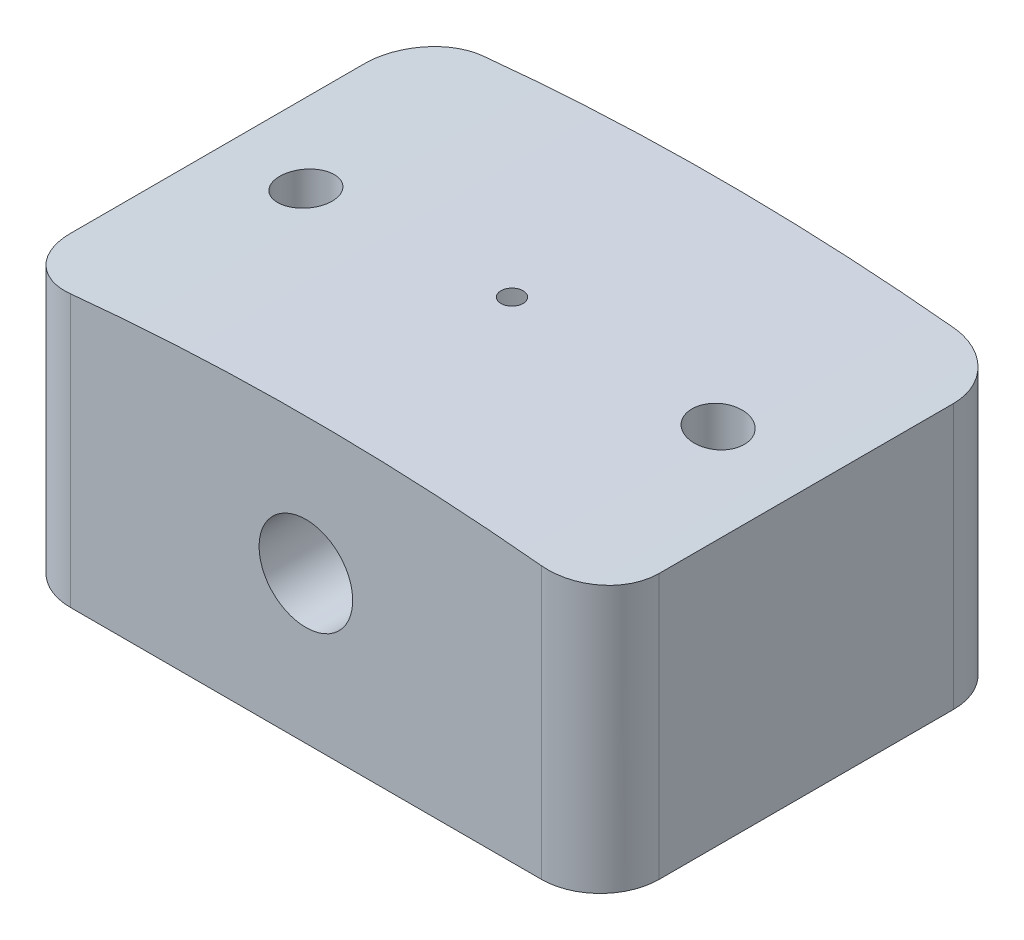
from build123d import *

# Parameters (mm, degrees)
BOSS_EXTRUDE1_DEPTH              = 8.89
BOSS_EXTRUDE1_DEPTH_BACK         = 8.89
F_3_8_0_375_DIAMETER_SLOT1_D     = 9.525
F_3_8_0_375_DIAMETER_SLOT1_DEPTH = 9.652
F_3_8_0_375_DIAMETER_SLOT1_TIP   = 2.861598698
TAP_DRILL_FOR_4_40_TAP1_D        = 2.2606
FILLET1_R                        = 2.54
F_10_32_TAPPED_HOLE1_D           = 4.0386


with BuildPart() as part:
    # Sketch1 → Boss-Extrude1 (new, two sides: drawn at the far end of the back side and taken through both)
    with BuildSketch(Plane.XY.offset(-BOSS_EXTRUDE1_DEPTH_BACK)):
        with BuildLine():
            Line((-12.698670317, 100.803292467), (-12.698670317, 89.373292467))
            Line((-12.698670317, 89.373292467), (12.698670317, 89.373292467))
            Line((12.698670317, 89.373292467), (12.698670317, 100.803292467))
            ThreePointArc((12.698670317, 100.803292467), (0, 101.6), (-12.698670317, 100.803292467))
        make_face()
    extrude(amount=BOSS_EXTRUDE1_DEPTH + BOSS_EXTRUDE1_DEPTH_BACK)

    # 3/8 (0.375) Diameter Slot1
    with Locations(Plane(origin=(0, 89.373292467, 0), x_dir=(-1, 0, 0), z_dir=(0, -1, 0))):
        with Locations((0, 0)):
            Hole(F_3_8_0_375_DIAMETER_SLOT1_D / 2, depth=F_3_8_0_375_DIAMETER_SLOT1_DEPTH)
            with Locations((0, 0, -(F_3_8_0_375_DIAMETER_SLOT1_DEPTH + F_3_8_0_375_DIAMETER_SLOT1_TIP / 2))):  # 118° drill point
                Cone(0, F_3_8_0_375_DIAMETER_SLOT1_D / 2, F_3_8_0_375_DIAMETER_SLOT1_TIP, mode=Mode.SUBTRACT)

    # Tap Drill for #4-40 Tap1 (through all)
    with Locations(Plane(origin=(0, 89.373292467, 0), x_dir=(-1, 0, 0), z_dir=(0, -1, 0))):
        with Locations((-8.888670317, 0), (8.888670317, 0)):
            Hole(TAP_DRILL_FOR_4_40_TAP1_D / 2)

    # Fillet1
    fillet1_edges = [part.edges().sort_by_distance(p)[0] for p in [
        (12.698670317, 95.088292467, 8.89),
        (-12.698670317, 95.088292467, -8.89),
        (-12.698670317, 95.088292467, 8.89),
        (12.698670317, 95.088292467, -8.89),
    ]]
    fillet(fillet1_edges, radius=FILLET1_R)

    # #10-32 Tapped Hole1 (through all)
    with Locations(Plane(origin=(0, 0, -8.89), x_dir=(-1, 0, 0), z_dir=(0, 0, -1))):
        with Locations((0, 95.723292467)):
            Hole(F_10_32_TAPPED_HOLE1_D / 2)


solid = part.part
